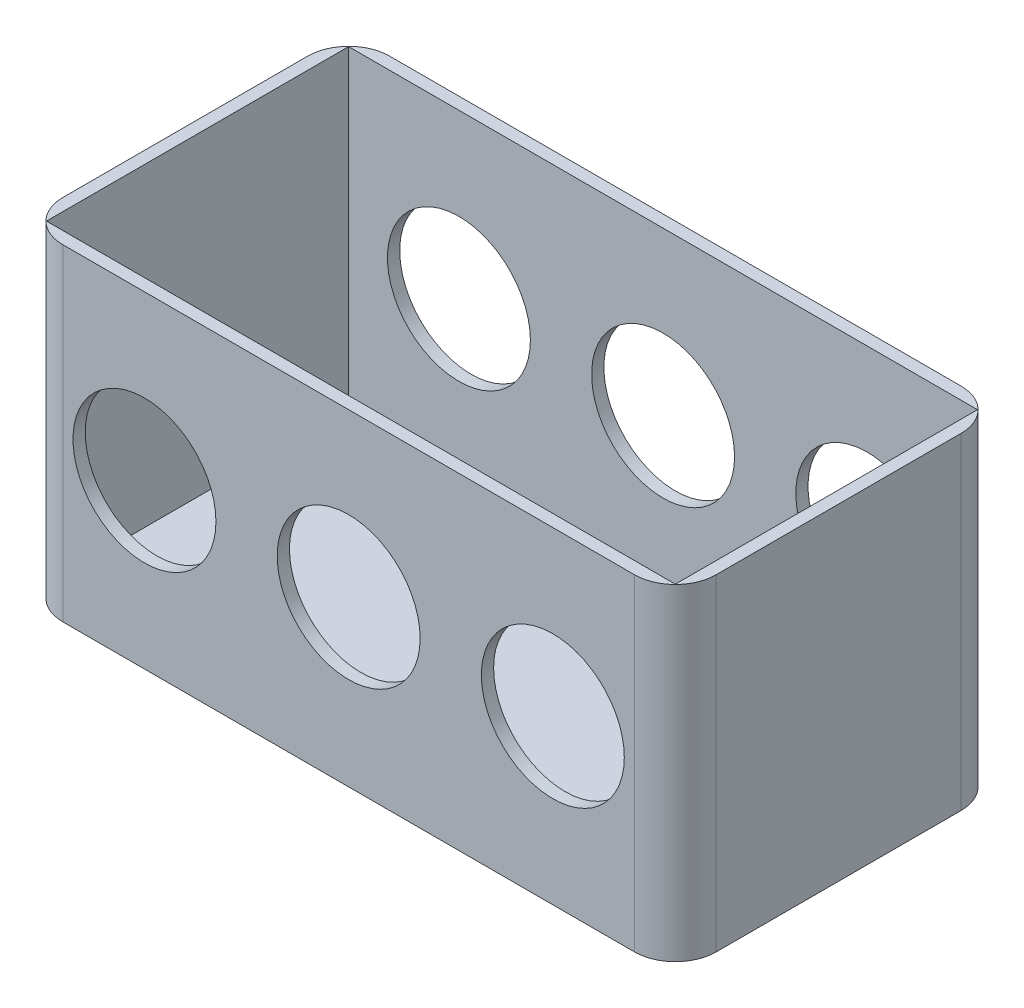
from build123d import *

# Parameters (mm, degrees)
SKETCH1_W           = 160
SKETCH1_H           = 80
BOSS_EXTRUDE1_DEPTH = 80
SHELL1_T            = -3
SKETCH2_R           = 17.5
CUT_EXTRUDE1_DEPTH  = 80
FILLET1_R           = 10


with BuildPart() as part:
    # Sketch1 → Boss-Extrude1 (new body)
    with BuildSketch(Plane(origin=(0, 0, 0), x_dir=(1, 0, 0), z_dir=(0, 1, 0))):
        Rectangle(SKETCH1_W, SKETCH1_H)
    extrude(amount=BOSS_EXTRUDE1_DEPTH)

    # Shell1
    shell1_openings = [part.faces().sort_by_distance(p)[0] for p in [
        (0, 80, 0),
    ]]
    offset(amount=SHELL1_T, openings=shell1_openings, kind=Kind.INTERSECTION)

    # Sketch2 → Cut-Extrude1 (cut)
    with BuildSketch(Plane.XY.offset(40)):
        with Locations((-50, 40)):
            Circle(SKETCH2_R)
        with Locations((0, 40.255057562)):
            Circle(SKETCH2_R)
        with Locations((50, 40)):
            Circle(SKETCH2_R)
    extrude(amount=-CUT_EXTRUDE1_DEPTH, mode=Mode.SUBTRACT)

    # Fillet1
    fillet1_edges = [part.edges().sort_by_distance(p)[0] for p in [
        (80, 40, 40),
        (-80, 40, 40),
        (-80, 40, -40),
        (80, 40, -40),
    ]]
    fillet(fillet1_edges, radius=FILLET1_R)


solid = part.part
